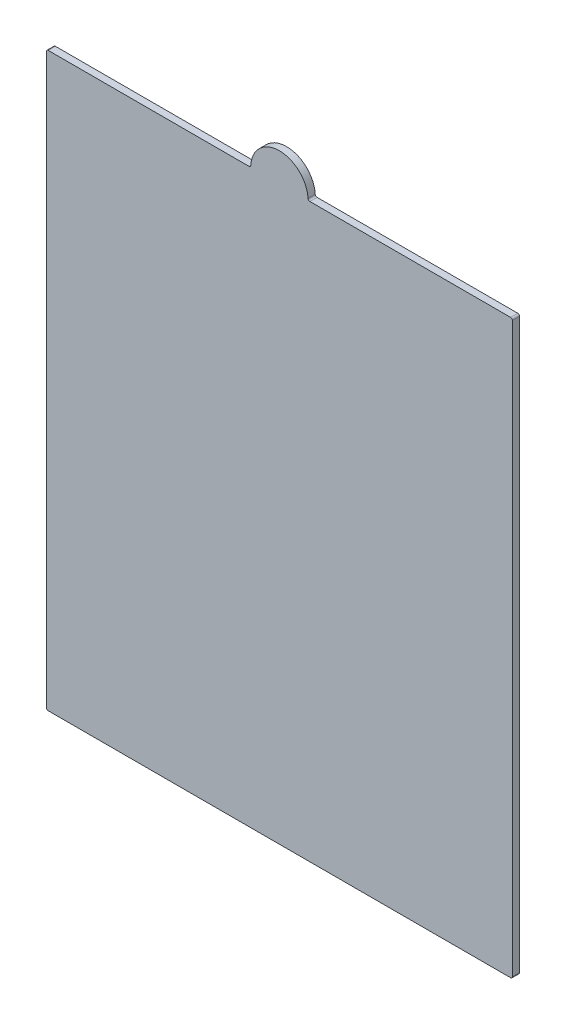
from build123d import *

# Parameters (mm, degrees)
SKETCH1_W           = 206.253
SKETCH1_H           = 253.103
BOSS_EXTRUDE1_DEPTH = 3.175
BOSS_EXTRUDE3_DEPTH = 3.175
FILLET1_R           = 0.79375


with BuildPart() as part:
    # Sketch1 → Boss-Extrude1 (new body)
    with BuildSketch(Plane.XY):
        with Locations((103.1265, 126.5515)):
            Rectangle(SKETCH1_W, SKETCH1_H)
    extrude(amount=BOSS_EXTRUDE1_DEPTH)

    # Sketch3 → Boss-Extrude3 (add)
    with BuildSketch(Plane.XY):
        with BuildLine():
            Line((90.4265, 253.103), (115.8265, 253.103))
            ThreePointArc((115.8265, 253.103), (103.1265, 265.803), (90.4265, 253.103))
        make_face()
    extrude(amount=BOSS_EXTRUDE3_DEPTH)

    # Fillet1
    fillet1_edges = [part.edges().sort_by_distance(p)[0] for p in [
        (115.8265, 253.103, 1.5875),
        (90.4265, 253.103, 1.5875),
        (0, 253.103, 1.5875),
        (206.253, 253.103, 1.5875),
        (206.253, 0, 1.5875),
        (0, 0, 1.5875),
    ]]
    fillet(fillet1_edges, radius=FILLET1_R)


solid = part.part
